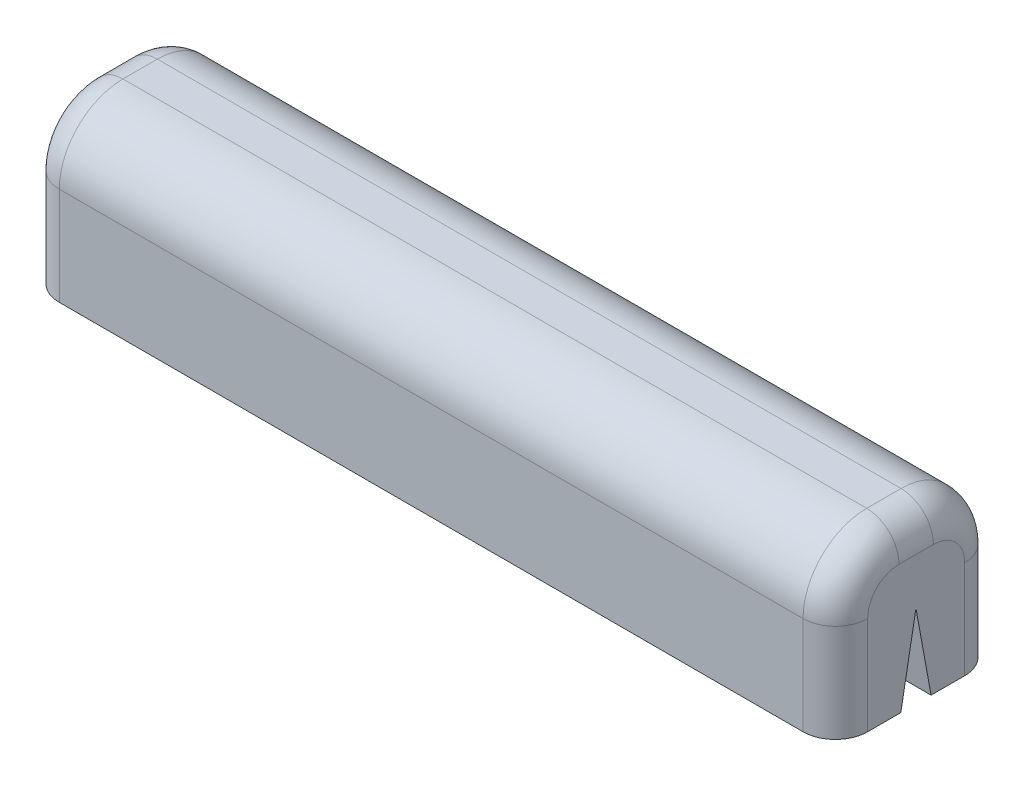
from build123d import *

# Parameters (mm, degrees)
BOSS_EXTRUDE1_DEPTH = 127
FILLET3_R           = 10
FILLET4_R           = 5.08


with BuildPart() as part:
    # Sketch1 → Boss-Extrude1 (new body)
    with BuildSketch(Plane(origin=(0, 0, 0), x_dir=(0, 0, -1), z_dir=(1, 0, 0))):
        Polygon((-4.750453706, 0), (-2.375226853, 12.992673374), (0, 0), (10.362546294, 0), (10.362546294, 25.4), (-15.037453706, 25.4), (-15.037453706, 0), align=None)
    extrude(amount=BOSS_EXTRUDE1_DEPTH)

    # Fillet3
    fillet3_edges = [part.edges().sort_by_distance(p)[0] for p in [
        (63.5, 25.4, 15.037453706),
        (63.5, 25.4, -10.362546294),
    ]]
    fillet(fillet3_edges, radius=FILLET3_R)

    # Fillet4
    fillet4_edges = [part.edges().sort_by_distance(p)[0] for p in [
        (0, 25.4, 2.337453706),
        (0, 7.7, -10.362546294),
        (0, 22.471067812, -7.433614106),
        (0, 22.471067812, 12.108521518),
        (127, 25.4, 2.337453706),
        (127, 7.7, -10.362546294),
        (127, 22.471067812, -7.433614106),
        (127, 22.471067812, 12.108521518),
        (127, 7.7, 15.037453706),
        (0, 7.7, 15.037453706),
    ]]
    fillet(fillet4_edges, radius=FILLET4_R)


solid = part.part
